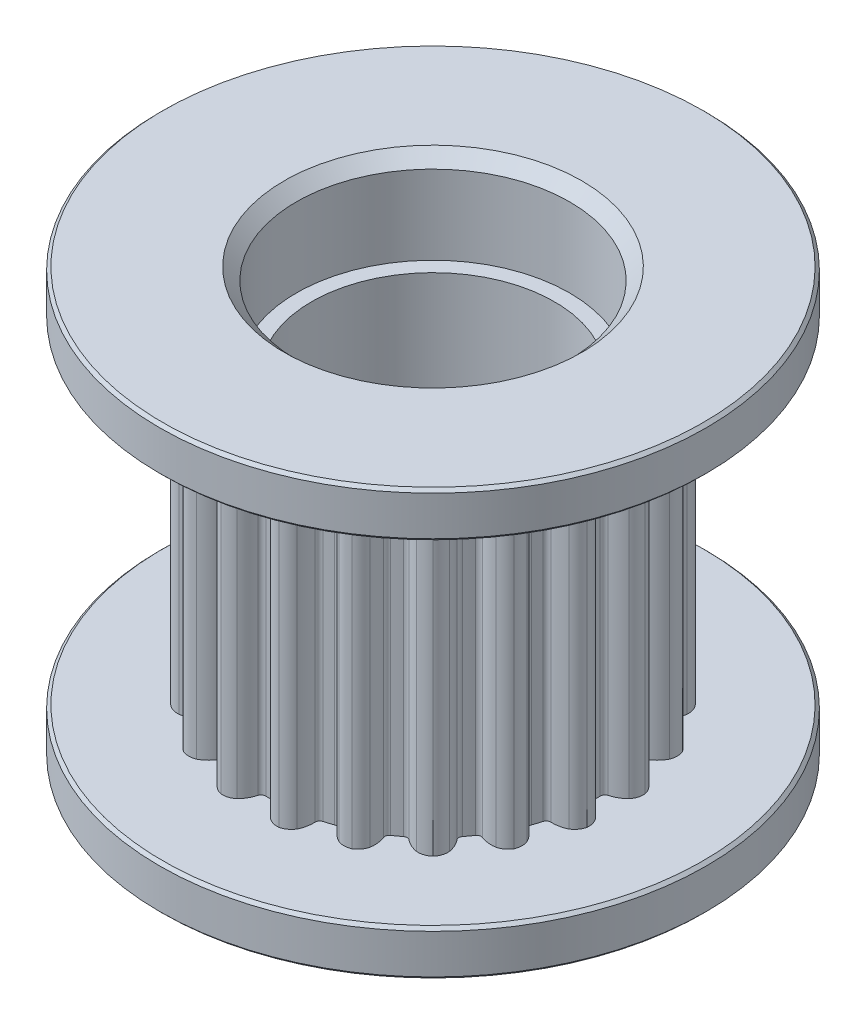
from build123d import *

# Parameters (mm, degrees)
GT2PROFILE_REACH             = 16.526
GT2PROFILE_DIRECTION_2_REACH = 16.526
GT2_GROOVE_CP_COUNT          = 20
INNERC_SIZE                  = 0.4
OUTERC_SIZE                  = 0.1


with BuildPart() as part:
    # BodyS → Body (revolve)
    with BuildSketch(Plane.XY, mode=Mode.PRIVATE) as body_sk:
        Polygon((6.11, -5.5), (6.11, 5.5), (9, 5.5), (9, 7), (4.5, 7), (4.5, 4), (4, 4), (4, -4), (4.5, -4), (4.5, -7), (9, -7), (9, -5.5), align=None)
    revolve(body_sk.sketch.rotate(Axis((0, 7, 0), (0, -1, 0)), 90), axis=Axis((0, 7, 0), (0, -1, 0)))

    # GT2Profile: up to this face of the body (flat: up to its plane)
    gt2profile_end = Plane(part.part.faces().sort_by_distance((0, -5.5, -8.745441559))[0])
    # GT2ProfileS → GT2Profile (cut, up to the picked face)
    with BuildSketch(Plane(origin=(0, 0, 0), x_dir=(1, 0, 0), z_dir=(0, 1, 0)), mode=Mode.PRIVATE) as gt2profile_sk1:
        with BuildLine():
            ThreePointArc((0.299749921, -5.468781955), (0.244461347, -5.387479579), (0.150701934, -5.357881011))
            ThreePointArc((0.150701934, -5.357881011), (0, -5.36), (-0.150701934, -5.357881011))
            ThreePointArc((-0.150701934, -5.357881011), (-0.244461347, -5.387479579), (-0.299749921, -5.468781955))
            ThreePointArc((-0.299749921, -5.468781955), (-0.396626607, -5.703924717), (-0.549685833, -5.907025885))
            ThreePointArc((-0.549685833, -5.907025885), (-0.7593874, -6.016293358), (-0.995541542, -6.028349446))
            ThreePointArc((-0.995541542, -6.028349446), (0, -6.11), (0.995541542, -6.028349446))
            ThreePointArc((0.995541542, -6.028349446), (0.7593874, -6.016293358), (0.549685833, -5.907025885))
            ThreePointArc((0.549685833, -5.907025885), (0.396626607, -5.703924717), (0.299749921, -5.468781955))
        make_face()
    gt2profile_tool1 = split(extrude(gt2profile_sk1.sketch, amount=-GT2PROFILE_REACH, mode=Mode.PRIVATE), bisect_by=gt2profile_end, keep=Keep.BOTH, mode=Mode.PRIVATE)
    gt2profile = gt2profile_tool1.solids().sort_by(Axis((0, 0, 5.802237), (0, -1, 0)))[0]
    add(gt2profile, mode=Mode.SUBTRACT)

    # GT2Profile direction 2: up to this face of the body (flat: up to its plane)
    gt2profile_direction_2_end = Plane(part.part.faces().sort_by_distance((0, 5.5, -6.364558441))[0])
    # GT2ProfileS → GT2Profile direction 2 (cut, up to the picked face)
    with BuildSketch(Plane(origin=(0, 0, 0), x_dir=(1, 0, 0), z_dir=(0, 1, 0)), mode=Mode.PRIVATE) as gt2profile_direction_2_sk1:
        with BuildLine():
            ThreePointArc((0.299749921, -5.468781955), (0.244461347, -5.387479579), (0.150701934, -5.357881011))
            ThreePointArc((0.150701934, -5.357881011), (0, -5.36), (-0.150701934, -5.357881011))
            ThreePointArc((-0.150701934, -5.357881011), (-0.244461347, -5.387479579), (-0.299749921, -5.468781955))
            ThreePointArc((-0.299749921, -5.468781955), (-0.396626607, -5.703924717), (-0.549685833, -5.907025885))
            ThreePointArc((-0.549685833, -5.907025885), (-0.7593874, -6.016293358), (-0.995541542, -6.028349446))
            ThreePointArc((-0.995541542, -6.028349446), (0, -6.11), (0.995541542, -6.028349446))
            ThreePointArc((0.995541542, -6.028349446), (0.7593874, -6.016293358), (0.549685833, -5.907025885))
            ThreePointArc((0.549685833, -5.907025885), (0.396626607, -5.703924717), (0.299749921, -5.468781955))
        make_face()
    gt2profile_direction_2_tool1 = split(extrude(gt2profile_direction_2_sk1.sketch, amount=GT2PROFILE_DIRECTION_2_REACH, mode=Mode.PRIVATE), bisect_by=gt2profile_direction_2_end, keep=Keep.BOTH, mode=Mode.PRIVATE)
    gt2profile_direction_2 = gt2profile_direction_2_tool1.solids().sort_by(Axis((0, 0, 5.802237), (0, 1, 0)))[0]
    add(gt2profile_direction_2, mode=Mode.SUBTRACT)

    # GT2 Groove CP: GT2Profile, GT2Profile direction 2 ×20 about axis
    gt2_groove_cp_axis = Axis((0, 0, 0), (0, 1, 0))
    add([gt2profile.rotate(gt2_groove_cp_axis, i * 360 / GT2_GROOVE_CP_COUNT) for i in range(1, GT2_GROOVE_CP_COUNT)], mode=Mode.SUBTRACT)
    add([gt2profile_direction_2.rotate(gt2_groove_cp_axis, i * 360 / GT2_GROOVE_CP_COUNT) for i in range(1, GT2_GROOVE_CP_COUNT)], mode=Mode.SUBTRACT)

    # InnerC
    innerc_edges = [part.edges().sort_by_distance(p)[0] for p in [
        (0, -7, -4.5),
        (0, 7, -4.5),
    ]]
    chamfer(innerc_edges, length=INNERC_SIZE)

    # OuterC
    outerc_edges = [part.edges().sort_by_distance(p)[0] for p in [
        (0, 7, -9),
        (0, 5.5, -9),
        (0, -5.5, -9),
        (0, -7, -9),
    ]]
    chamfer(outerc_edges, length=OUTERC_SIZE)


solid = part.part
